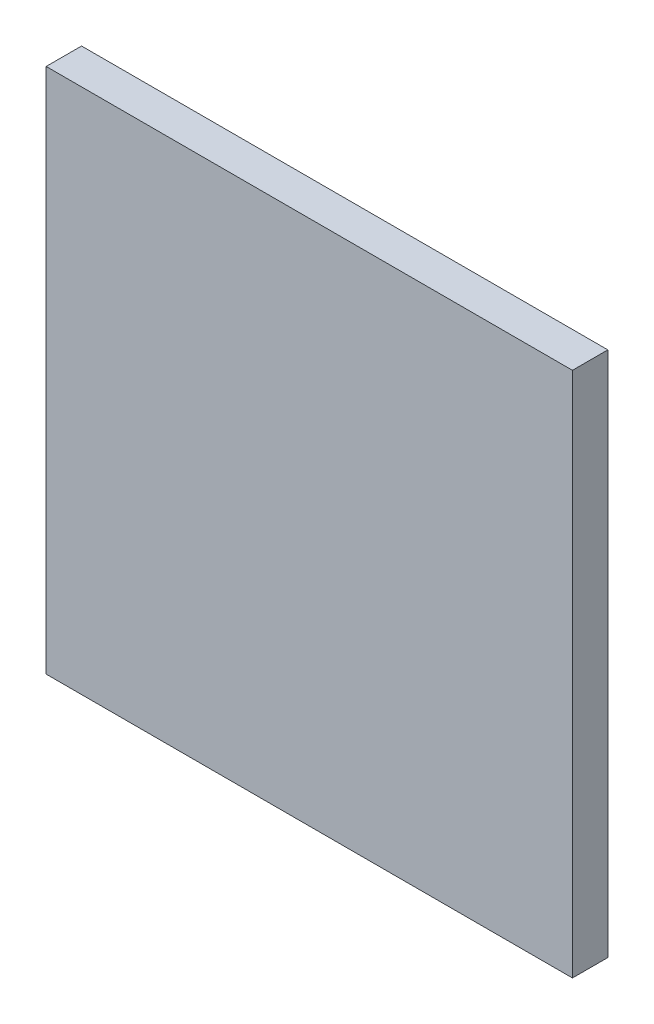
from build123d import *

# Parameters (mm, degrees)
SKETCH1_W           = 8.92
SKETCH1_H           = 8.92
BOSS_EXTRUDE1_DEPTH = 0.6


with BuildPart() as part:
    # Sketch1 → Boss-Extrude1 (new body)
    with BuildSketch(Plane.XY):
        with Locations((4.46, -4.46)):
            Rectangle(SKETCH1_W, SKETCH1_H)
    extrude(amount=BOSS_EXTRUDE1_DEPTH)


solid = part.part
